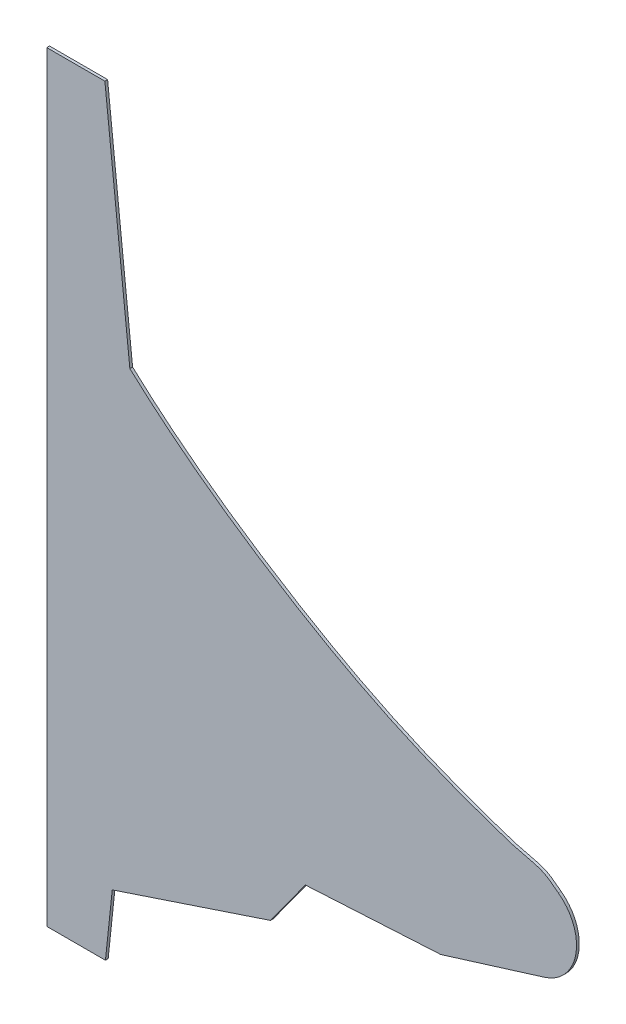
from build123d import *

# Parameters (mm, degrees)
ESTRUSIONE_ESTRUSIONE1_DEPTH = 0.23


with BuildPart() as part:
    # Schizzo1 → Estrusione-Estrusione1 (new body)
    with BuildSketch(Plane.XY):
        with BuildLine():
            Line((10.365422141, 74.831373189), (10.365422141, 10.776707028))
            Line((10.365422141, 10.776707028), (15.302975319, 10.776707028))
            Line((15.302975319, 10.776707028), (15.876492425, 16.195196671))
            Line((15.876492425, 16.195196671), (29.195225145, 20.626716392))
            Line((29.195225145, 20.626716392), (32.131109214, 24.67621166))
            Line((32.131109214, 24.67621166), (43.520662662, 25.30654369))
            Line((43.520662662, 25.30654369), (52.251515817, 28.012420469))
            ThreePointArc((52.251515817, 28.012420469), (54.897133641, 31.018238504), (53.429432122, 34.743837514))
            add(Edge.make_bspline(
                [(17.359204401, 54.927140115), (21.375816351, 51.220919189), (27.618442159, 46.746271927), (36.534382122, 41.577775958), (42.465635871, 38.811252867), (47.453351059, 37.034127022), (49.931237279, 36.200286751), (51.283695675, 35.917869324), (52.269703163, 35.613114476), (52.708293272, 35.323272886), (53.429432122, 34.743837514)],
                knots=[0, 0, 0, 0, 0.391004562, 0.550370193, 0.736981075, 0.865480125, 0.91648803, 0.943203729, 0.951554926, 1, 1, 1, 1], degree=3))
            Line((17.359204401, 54.927140115), (15.256321742, 74.831373189))
            Line((15.256321742, 74.831373189), (10.365422141, 74.831373189))
        make_face()
    extrude(amount=ESTRUSIONE_ESTRUSIONE1_DEPTH)


solid = part.part
